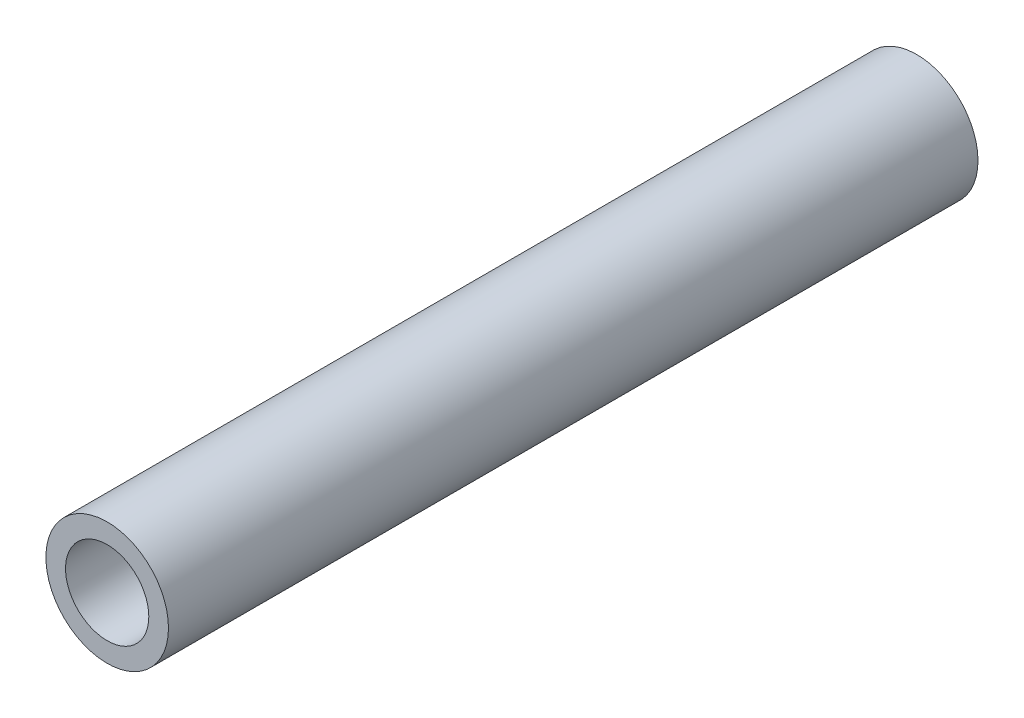
from build123d import *

# Parameters (mm, degrees)
SKETCH1_R           = 2.65
SKETCH1_R_2         = 1.8
BOSS_EXTRUDE1_DEPTH = 35


with BuildPart() as part:
    # Sketch1 → Boss-Extrude1 (new body)
    with BuildSketch(Plane.XY):
        Circle(SKETCH1_R)
        Circle(SKETCH1_R_2, mode=Mode.SUBTRACT)
    extrude(amount=BOSS_EXTRUDE1_DEPTH)


solid = part.part
